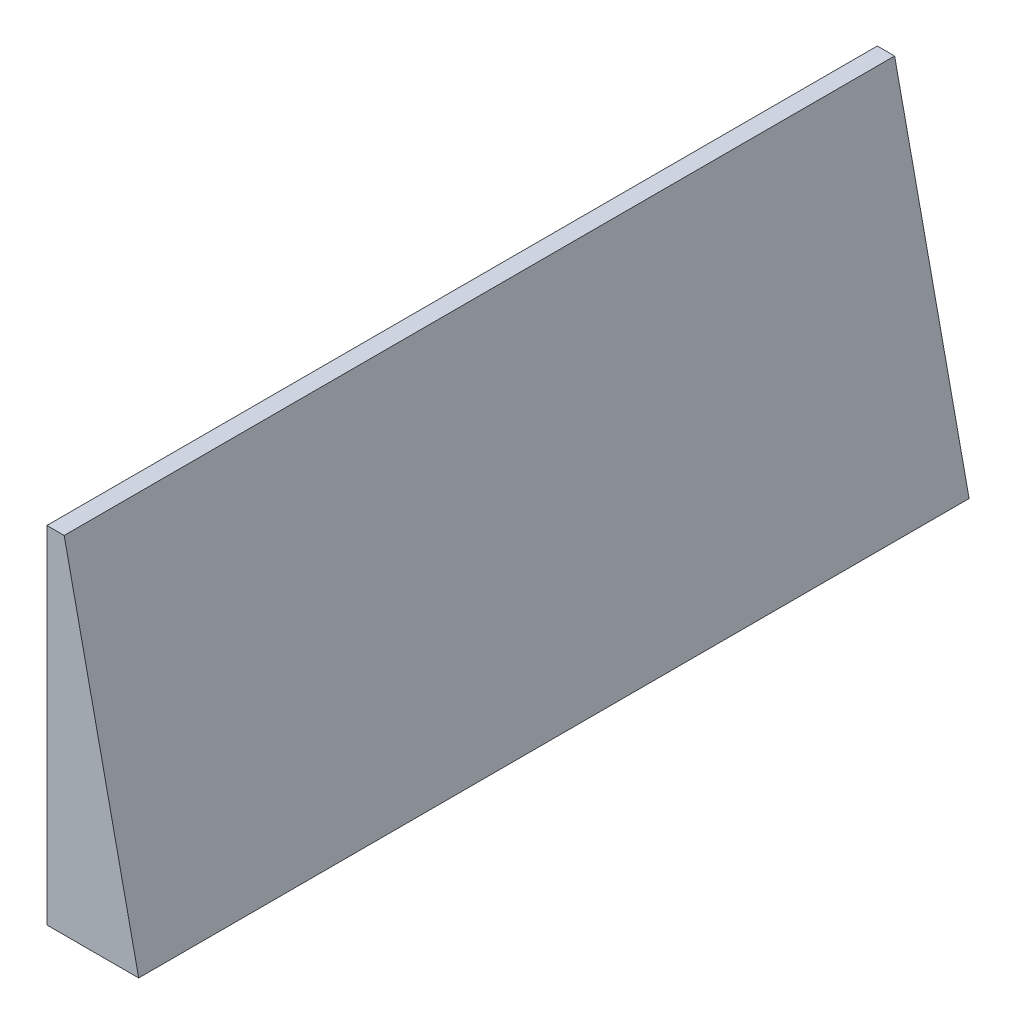
from build123d import *

# Parameters (mm, degrees)
BOSS_EXTRUDE1_DEPTH = 76.2


with BuildPart() as part:
    # Sketch1 → Boss-Extrude1 (new, symmetric)
    with BuildSketch(Plane.XY):
        Polygon((-1.5875, 31.75), (1.5875, 31.75), (15.258692307, -31.75), (-1.5875, -31.75), align=None)
    extrude(amount=BOSS_EXTRUDE1_DEPTH, both=True)


solid = part.part
